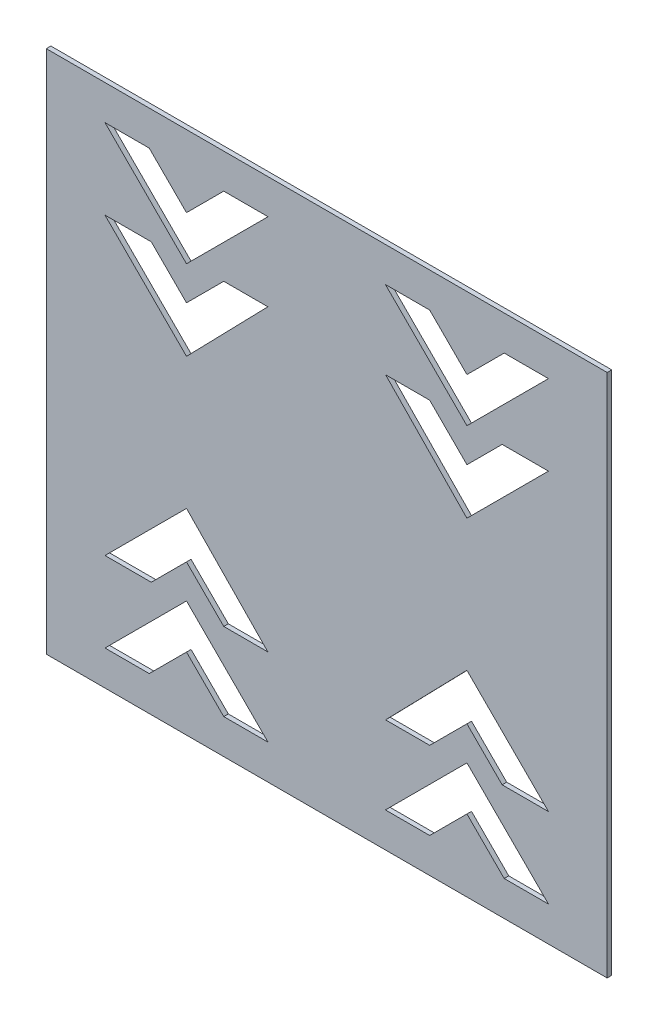
from build123d import *

# Parameters (mm, degrees)
SKETCH_1_W            = 246
SKETCH_1_H            = 230
EXTRUDE_1_DEPTH       = 2
CUT_EXTRUDE_2_DEPTH   = 169.398337284
MIRROR_2_COPY_1_DEPTH = 169.398337284


with BuildPart() as part:
    # 草图1 → 凸台-拉伸1 (new body)
    with BuildSketch(Plane.XY):
        Rectangle(SKETCH_1_W, SKETCH_1_H)
    extrude(amount=EXTRUDE_1_DEPTH)

    # 草图2 → 切除-拉伸2 (cut, through all)
    with BuildSketch(Plane.XY.offset(2)):
        Polygon((-61.485344815, -28.880757709), (-97.255935728, -64.651348622), (-76.945987349, -64.651348622), (-61.5, -49.205361273), (-45.159781882, -65.545579391), (-25.813195161, -65.545579391), align=None)
        Polygon((-61.5, -64.03252581), (-97.255935728, -99.788461538), (-77.840218118, -99.788461538), (-61.5, -83.44824342), (-45.159781882, -99.788461538), (-25.744064272, -99.788461538), align=None)
    cut_extrude_2 = extrude(amount=-CUT_EXTRUDE_2_DEPTH, mode=Mode.SUBTRACT)

    # 镜向1: 切除-拉伸2 across plane
    add(cut_extrude_2.mirror(Plane.ZX), mode=Mode.SUBTRACT)

    # 镜向2: 切除-拉伸2 across plane
    add(cut_extrude_2.mirror(Plane(origin=(0, 0, 0), x_dir=(0, 0, 1), z_dir=(1, 0, 0))), mode=Mode.SUBTRACT)

    # 镜向2 copy 1 sketch → 镜向2 copy 1 (cut, through all)
    with BuildSketch(Plane(origin=(0, 0, 2), x_dir=(-1, 0, 0), z_dir=(0, 0, 1))):
        Polygon((-61.485344815, -28.880757709), (-97.255935728, -64.651348622), (-76.945987349, -64.651348622), (-61.5, -49.205361273), (-45.159781882, -65.545579391), (-25.813195161, -65.545579391), align=None)
        Polygon((-61.5, -64.03252581), (-97.255935728, -99.788461538), (-77.840218118, -99.788461538), (-61.5, -83.44824342), (-45.159781882, -99.788461538), (-25.744064272, -99.788461538), align=None)
    extrude(amount=-MIRROR_2_COPY_1_DEPTH, mode=Mode.SUBTRACT)


solid = part.part
